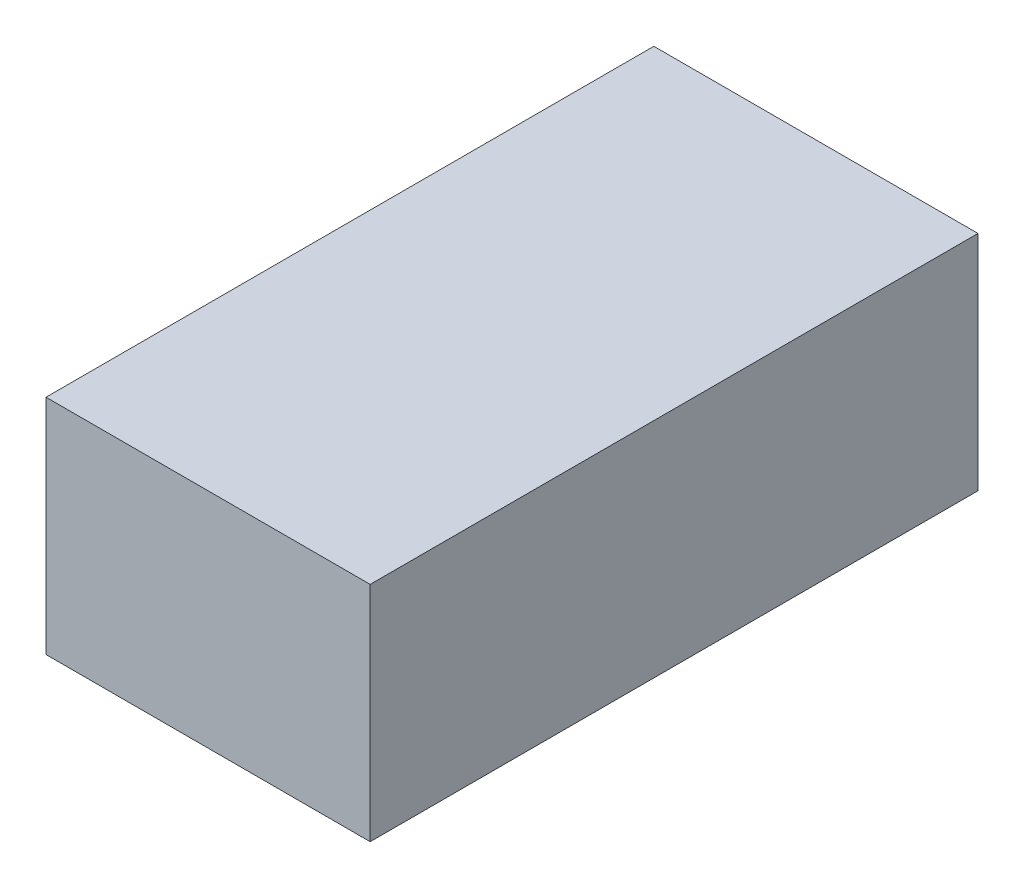
from build123d import *

# Parameters (mm, degrees)
SKETCH_1_W      = 80
SKETCH_1_H      = 55
EXTRUDE_1_DEPTH = 150


with BuildPart() as part:
    # 草图1 → 凸台-拉伸1 (new body)
    with BuildSketch(Plane.XY):
        with Locations((40, 27.5)):
            Rectangle(SKETCH_1_W, SKETCH_1_H)
    extrude(amount=EXTRUDE_1_DEPTH)


solid = part.part
